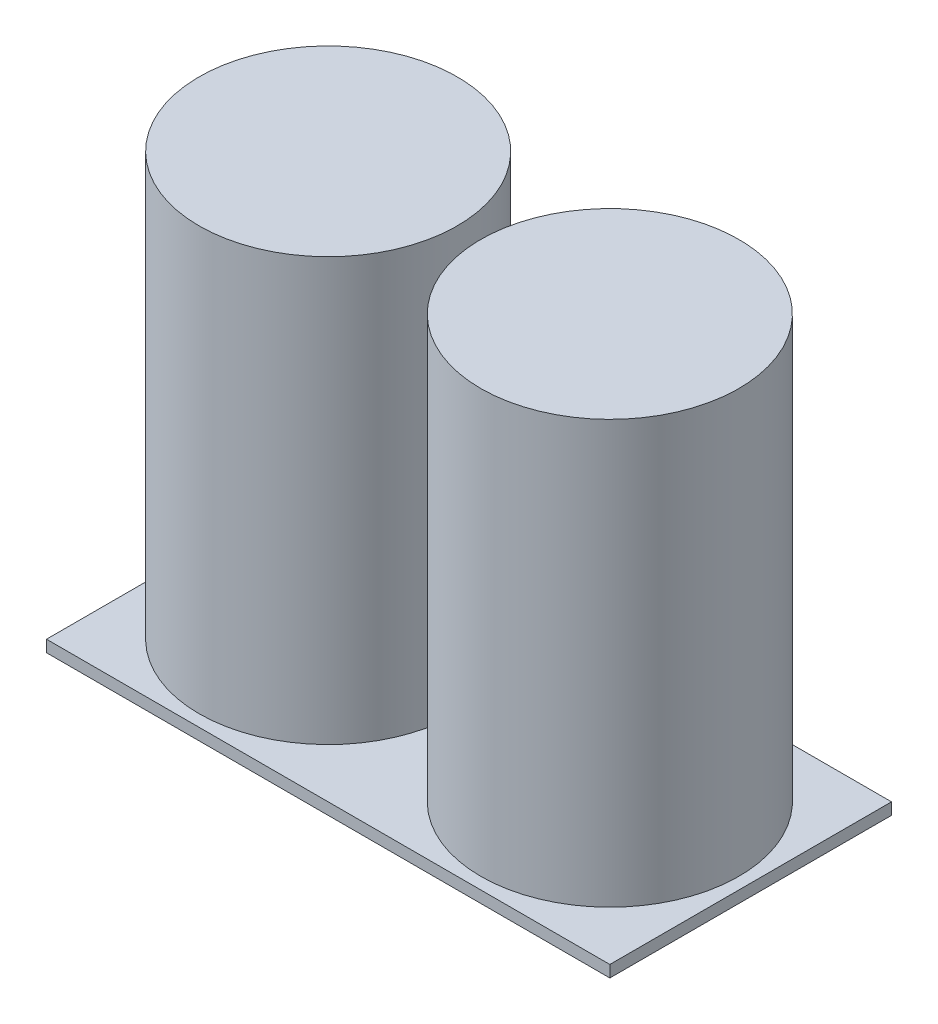
from build123d import *

# Parameters (mm, degrees)
SKETCH1_W           = 1219.2
SKETCH1_H           = 609.6
BOSS_EXTRUDE1_DEPTH = 25.4
SKETCH2_R           = 279.4
BOSS_EXTRUDE2_DEPTH = 914.4


with BuildPart() as part:
    # Sketch1 → Boss-Extrude1 (new body)
    with BuildSketch(Plane(origin=(0, 0, 0), x_dir=(1, 0, 0), z_dir=(0, 1, 0))):
        Rectangle(SKETCH1_W, SKETCH1_H)
    extrude(amount=BOSS_EXTRUDE1_DEPTH)

    # Sketch2 → Boss-Extrude2 (add)
    with BuildSketch(Plane(origin=(0, 25.4, 0), x_dir=(1, 0, 0), z_dir=(0, 1, 0))):
        with Locations(Location((-304.8, 0, 0), (0, 0, 270))):
            Circle(SKETCH2_R)
        with Locations(Location((304.8, 0, 0), (0, 0, 270))):
            Circle(SKETCH2_R)
    extrude(amount=BOSS_EXTRUDE2_DEPTH)


solid = part.part
